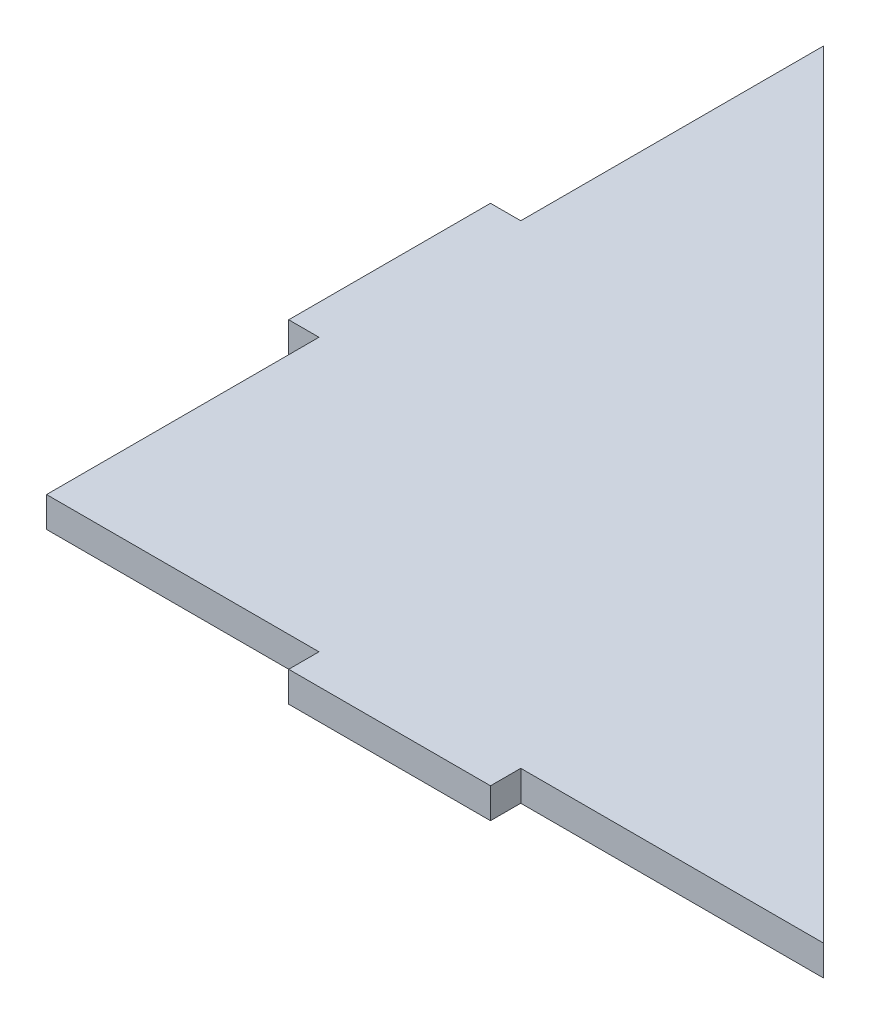
from build123d import *

# Parameters (mm, degrees)
SALIENTE_EXTRUIR1_DEPTH = 3


with BuildPart() as part:
    # Croquis1 → Saliente-Extruir1 (new body)
    with BuildSketch(Plane(origin=(0, 0, 0), x_dir=(1, 0, 0), z_dir=(0, 1, 0))):
        Polygon((0, 0), (27, 0), (27, -3), (37, -3), (47, -3), (47, 0), (77, 0), (0, 77), (0, 47), (-3, 47), (-3, 37), (-3, 27), (0, 27), align=None)
    extrude(amount=SALIENTE_EXTRUIR1_DEPTH)


solid = part.part
